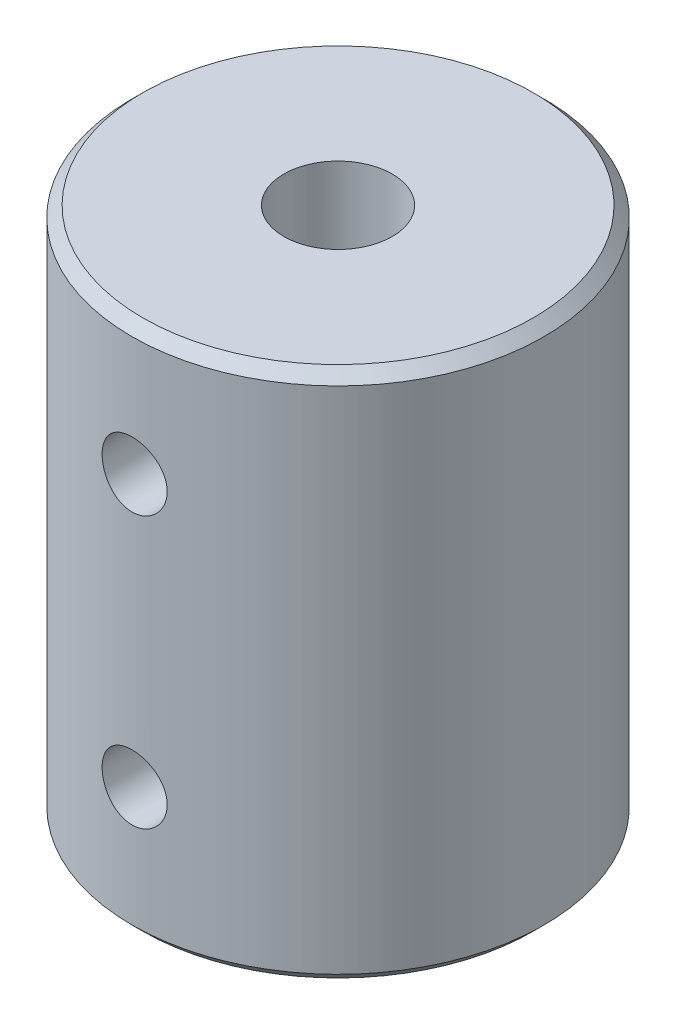
from build123d import *

# Parameters (mm, degrees)
SKETCH_1_R          = 9.5
SKETCH_1_R_2        = 2.5
EXTRUDE_1_DEPTH     = 24.5
CHAMFER_1_SIZE      = 0.5
SKETCH_2_R          = 4
CUT_EXTRUDE_1_DEPTH = 10
SKETCH_3_R          = 1.5
CUT_EXTRUDE_2_DEPTH = 10


with BuildPart() as part:
    # 草图1 → 凸台-拉伸1 (new body)
    with BuildSketch(Plane(origin=(0, 0, 0), x_dir=(1, 0, 0), z_dir=(0, 1, 0))):
        with Locations(Location((0, 0, 0), (0, 0, 270))):
            Circle(SKETCH_1_R)
        with Locations(Location((0, 0, 0), (0, 0, 270))):
            Circle(SKETCH_1_R_2, mode=Mode.SUBTRACT)
    extrude(amount=EXTRUDE_1_DEPTH)

    # 倒角1
    chamfer_1_edges = [part.edges().sort_by_distance(p)[0] for p in [
        (0, 0, -9.5),
        (0, 24.5, -9.5),
    ]]
    chamfer(chamfer_1_edges, length=CHAMFER_1_SIZE)

    # 草图2 → 切除-拉伸1 (cut)
    with BuildSketch(Plane.XZ):
        with Locations(Location((0, 0, 0), (0, 0, 270))):
            Circle(SKETCH_2_R)
    extrude(amount=-CUT_EXTRUDE_1_DEPTH, mode=Mode.SUBTRACT)

    # 草图3 → 切除-拉伸2 (cut)
    with BuildSketch(Plane.XY.offset(9.5)):
        with Locations((0, 6)):
            Circle(SKETCH_3_R)
        with Locations((0, 18.5)):
            Circle(SKETCH_3_R)
    extrude(amount=-CUT_EXTRUDE_2_DEPTH, mode=Mode.SUBTRACT)


solid = part.part
